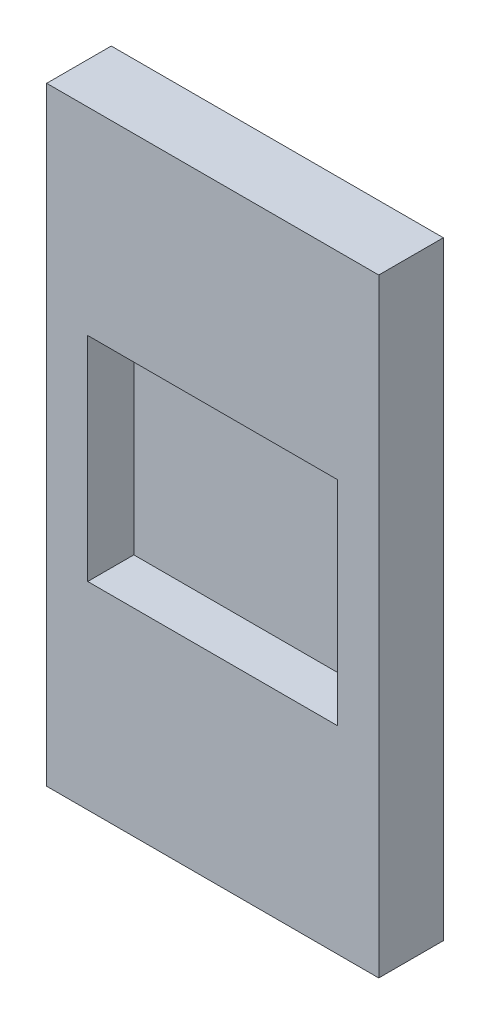
from build123d import *

# Parameters (mm, degrees)
SKETCH_1_W          = 18
SKETCH_1_H          = 33
EXTRUDE_1_DEPTH     = 3.5
SKETCH_2_W          = 13.55
SKETCH_2_H          = 11.55
CUT_EXTRUDE_1_DEPTH = 2.5


with BuildPart() as part:
    # 스케치1 → 보스-돌출1 (new body)
    with BuildSketch(Plane.XY):
        Rectangle(SKETCH_1_W, SKETCH_1_H)
    extrude(amount=EXTRUDE_1_DEPTH)

    # 스케치2 → 컷-돌출1 (cut)
    with BuildSketch(Plane.XY.offset(3.5)):
        Rectangle(SKETCH_2_W, SKETCH_2_H)
    extrude(amount=-CUT_EXTRUDE_1_DEPTH, mode=Mode.SUBTRACT)


solid = part.part
